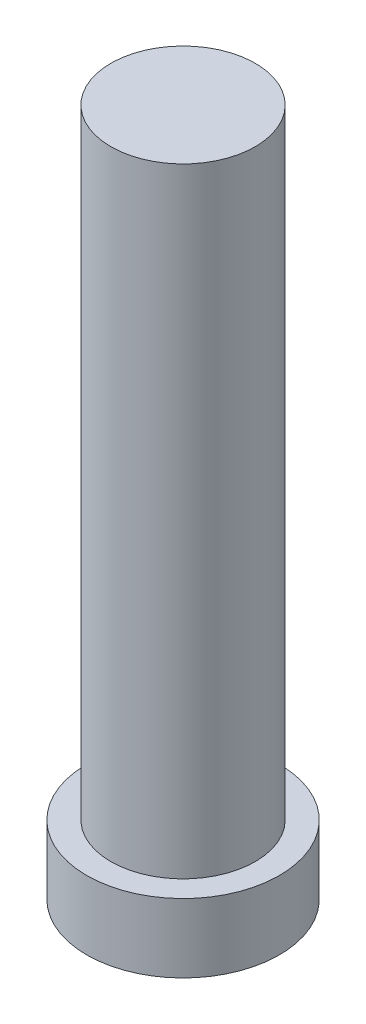
from build123d import *

# Parameters (mm, degrees)
SKETCH1_R           = 1.778
BOSS_EXTRUDE1_DEPTH = 1.27
SKETCH3_R           = 1.3335
BOSS_EXTRUDE2_DEPTH = 11.43


with BuildPart() as part:
    # Sketch1 → Boss-Extrude1 (new body)
    with BuildSketch(Plane(origin=(0, 0, 0), x_dir=(1, 0, 0), z_dir=(0, 1, 0))):
        with Locations(Location((0, 0, 0), (0, 0, 270))):
            Circle(SKETCH1_R)
    extrude(amount=BOSS_EXTRUDE1_DEPTH)

    # Sketch3 → Boss-Extrude2 (add)
    with BuildSketch(Plane(origin=(0, 1.27, 0), x_dir=(1, 0, 0), z_dir=(0, 1, 0))):
        with Locations(Location((0, 0, 0), (0, 0, 270))):
            Circle(SKETCH3_R)
    extrude(amount=BOSS_EXTRUDE2_DEPTH)


solid = part.part
